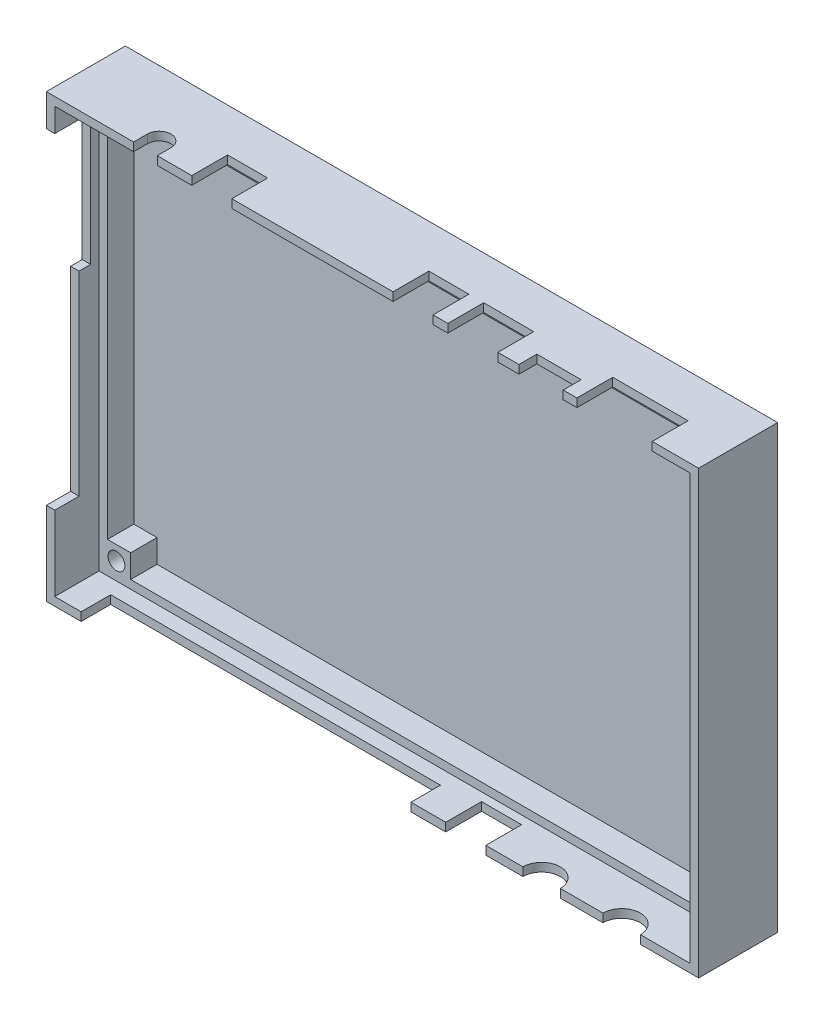
from build123d import *

# Parameters (mm, degrees)
SKETCH1_W            = 120.6
SKETCH1_H            = 80.6
BOSS_EXTRUDE1_DEPTH  = 1.6
SKETCH2_W            = 123.8
SKETCH2_H            = 83.8
SKETCH2_W_2          = 120.6
SKETCH2_H_2          = 80.6
BOSS_EXTRUDE2_DEPTH  = 8.2
SKETCH3_W            = 120.6
SKETCH3_H            = 80.6
BOSS_EXTRUDE3_DEPTH  = 5
SKETCH4_R            = 1.6
CUT_EXTRUDE1_DEPTH   = 5
SKETCH5_W            = 40.4
SKETCH5_H            = 1.6
SKETCH5_W_2          = 6.6
BOSS_EXTRUDE4_DEPTH  = 6.8
SKETCH6_R            = 3.55
CUT_EXTRUDE2_DEPTH   = 6.8
BOSS_EXTRUDE5_DEPTH  = 6.8
SKETCH8_W            = 1.6
SKETCH8_H            = 37
BOSS_EXTRUDE6_DEPTH  = 2.2
SKETCH9_W            = 30.6
SKETCH9_H            = 1.6
SKETCH9_W_2          = 2.8
BOSS_EXTRUDE7_DEPTH  = 6.8
CUT_EXTRUDE3_DEPTH   = 6.8
SKETCH11_W           = 15
SKETCH11_H           = 1.6
BOSS_EXTRUDE8_DEPTH  = 6.8
SKETCH12_W           = 8.4
SKETCH12_H           = 3.4
CUT_EXTRUDE4_DEPTH   = 6.8
BOSS_EXTRUDE9_DEPTH  = 6.8
SKETCH14_W           = 62.6
SKETCH14_H           = 1.6
BOSS_EXTRUDE10_DEPTH = 1.2


with BuildPart() as part:
    # Sketch1 → Boss-Extrude1 (new body)
    with BuildSketch(Plane.XY):
        Rectangle(SKETCH1_W, SKETCH1_H)
    extrude(amount=BOSS_EXTRUDE1_DEPTH)

    # Sketch2 → Boss-Extrude2 (add)
    with BuildSketch(Plane.XY):
        Rectangle(SKETCH2_W, SKETCH2_H)
        Rectangle(SKETCH2_W_2, SKETCH2_H_2, mode=Mode.SUBTRACT)
    extrude(amount=BOSS_EXTRUDE2_DEPTH)

    # Sketch3 → Boss-Extrude3 (add)
    with BuildSketch(Plane.XY.offset(1.6)):
        Rectangle(SKETCH3_W, SKETCH3_H)
        Polygon((-58.7, 34.3), (-54.3, 34.3), (-54.3, 38.5), (54.3, 38.5), (54.3, 34.3), (58.7, 34.3), (58.7, -34.3), (54.3, -34.3), (54.3, -38.7), (-54.3, -38.7), (-54.3, -34.3), (-58.7, -34.3), align=None, mode=Mode.SUBTRACT)
    extrude(amount=BOSS_EXTRUDE3_DEPTH)

    # Sketch4 → Cut-Extrude1 (cut)
    with BuildSketch(Plane.XY.offset(6.6)):
        with Locations((-57, 37)):
            Circle(SKETCH4_R)
        with Locations((57, 37)):
            Circle(SKETCH4_R)
        with Locations((57, -37)):
            Circle(SKETCH4_R)
        with Locations((-57, -37)):
            Circle(SKETCH4_R)
    extrude(amount=-CUT_EXTRUDE1_DEPTH, mode=Mode.SUBTRACT)

    # Sketch5 → Boss-Extrude4 (add)
    with BuildSketch(Plane.XY.offset(8.2)):
        with Locations((41.7, -41.1)):
            Rectangle(SKETCH5_W, SKETCH5_H)
        with Locations((10.6, -41.1)):
            Rectangle(SKETCH5_W_2, SKETCH5_H)
    extrude(amount=BOSS_EXTRUDE4_DEPTH)

    # Sketch6 → Cut-Extrude2 (cut)
    with BuildSketch(Plane.XZ.offset(41.9)):
        with Locations((32.1, 15)):
            Circle(SKETCH6_R)
        with Locations((47.3, 15)):
            Circle(SKETCH6_R)
    extrude(amount=-CUT_EXTRUDE2_DEPTH, mode=Mode.SUBTRACT)

    # Sketch7 → Boss-Extrude5 (add)
    with BuildSketch(Plane.XY.offset(8.2)):
        Polygon((-61.9, -26.1), (-61.9, -41.9), (-55.3, -41.9), (-55.3, -40.3), (-60.3, -40.3), (-60.3, -26.1), align=None)
    extrude(amount=BOSS_EXTRUDE5_DEPTH)

    # Sketch8 → Boss-Extrude6 (add)
    with BuildSketch(Plane.XY.offset(8.2)):
        with Locations((-61.1, -7.6)):
            Rectangle(SKETCH8_W, SKETCH8_H)
    extrude(amount=BOSS_EXTRUDE6_DEPTH)

    # Sketch9 → Boss-Extrude7 (add)
    with BuildSketch(Plane.XY.offset(8.2)):
        Polygon((-60.3, 35.8), (-61.9, 35.8), (-61.9, 41.9), (-34.3, 41.9), (-34.3, 40.3), (-60.3, 40.3), align=None)
        with Locations((-11.4, 41.1)):
            Rectangle(SKETCH9_W, SKETCH9_H)
        with Locations((12.9, 41.1)):
            Rectangle(SKETCH9_W_2, SKETCH9_H)
    extrude(amount=BOSS_EXTRUDE7_DEPTH)

    # Sketch10 → Cut-Extrude3 (cut)
    with BuildSketch(Plane(origin=(0, 41.9, 0), x_dir=(1, 0, 0), z_dir=(0, 1, 0))):
        with BuildLine():
            Line((-45.35, -12.4), (-45.35, -15))
            Line((-45.35, -15), (-40.85, -15))
            Line((-40.85, -15), (-40.85, -12.4))
            ThreePointArc((-40.85, -12.4), (-43.1, -10.15), (-45.35, -12.4))
        make_face()
    extrude(amount=-CUT_EXTRUDE3_DEPTH, mode=Mode.SUBTRACT)

    # Sketch11 → Boss-Extrude8 (add)
    with BuildSketch(Plane.XY.offset(8.2)):
        with Locations((31.3, 41.1)):
            Rectangle(SKETCH11_W, SKETCH11_H)
    extrude(amount=BOSS_EXTRUDE8_DEPTH)

    # Sketch12 → Cut-Extrude4 (cut)
    with BuildSketch(Plane(origin=(0, 41.9, 0), x_dir=(1, 0, 0), z_dir=(0, 1, 0))):
        with Locations((32, -13.3)):
            Rectangle(SKETCH12_W, SKETCH12_H)
    extrude(amount=-CUT_EXTRUDE4_DEPTH, mode=Mode.SUBTRACT)

    # Sketch13 → Boss-Extrude9 (add)
    with BuildSketch(Plane.XY.offset(8.2)):
        Polygon((61.9, -40.3), (60.3, -40.3), (60.3, 40.3), (53.1, 40.3), (53.1, 41.9), (61.9, 41.9), align=None)
    extrude(amount=BOSS_EXTRUDE9_DEPTH)

    # Sketch14 → Boss-Extrude10 (add)
    with BuildSketch(Plane.XY.offset(8.2)):
        with Locations((-24, -41.1)):
            Rectangle(SKETCH14_W, SKETCH14_H)
    extrude(amount=BOSS_EXTRUDE10_DEPTH)


solid = part.part
